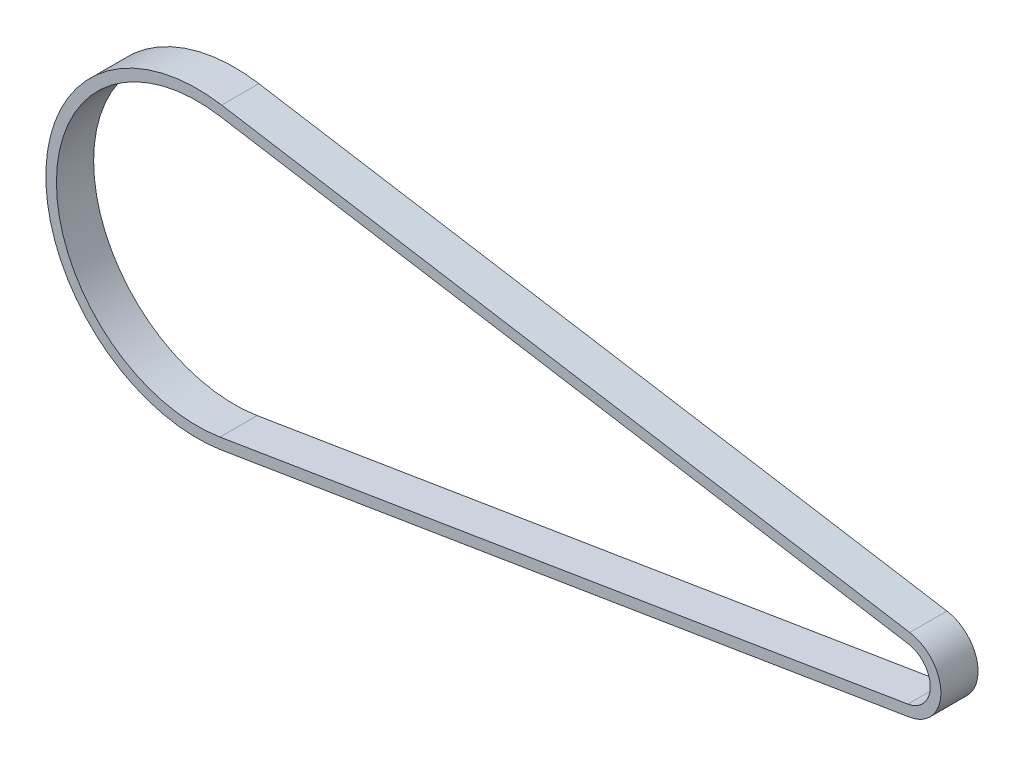
from build123d import *

# Parameters (mm, degrees)
BOSS_EXTRUDE1_DEPTH = 7


with BuildPart() as part:
    # Sketch1 → Boss-Extrude1 (new body)
    with BuildSketch(Plane.XY):
        with BuildLine():
            Line((4.607142857, 28.125153061), (134.131578947, 6.907932331))
            ThreePointArc((134.131578947, 6.907932331), (140, 0), (134.131578947, -6.907932331))
            Line((134.131578947, -6.907932331), (4.607142857, -28.125153061))
            ThreePointArc((4.607142857, -28.125153061), (-28.5, 0), (4.607142857, 28.125153061))
        make_face()
        with BuildLine():
            Line((4.283834586, 26.151458109), (133.808270677, 4.934237379))
            ThreePointArc((133.808270677, 4.934237379), (138, 0), (133.808270677, -4.934237379))
            Line((133.808270677, -4.934237379), (4.283834586, -26.151458109))
            ThreePointArc((4.283834586, -26.151458109), (-26.5, 0), (4.283834586, 26.151458109))
        make_face(mode=Mode.SUBTRACT)
    extrude(amount=BOSS_EXTRUDE1_DEPTH)


solid = part.part
